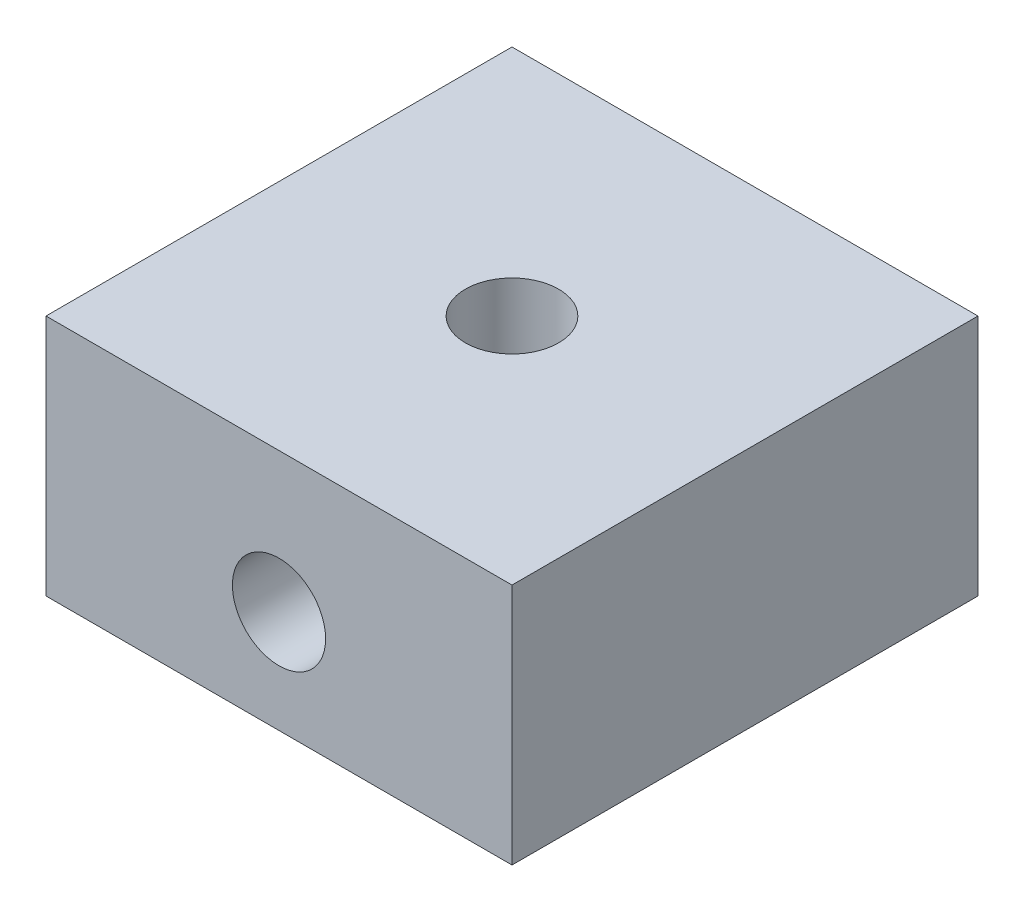
from build123d import *

# Parameters (mm, degrees)
BOSS_EXTRUDE1_DEPTH      = 25
BOSS_EXTRUDE1_DEPTH_BACK = 1.0186
SKETCH1_W                = 50
SKETCH1_H                = 50
SKETCH11_R               = 5
CUT_EXTRUDE17_DEPTH      = 15
SKETCH14_R               = 5
CUT_EXTRUDE18_DEPTH      = 25


with BuildPart() as part:
    # Sketch1 → Boss-Extrude1 (new, two sides: drawn at the far end of the back side and taken through both)
    with BuildSketch(Plane(origin=(0, 0, 0), x_dir=(1, 0, 0), z_dir=(0, 1, 0)).offset(-BOSS_EXTRUDE1_DEPTH_BACK)):
        Rectangle(SKETCH1_W, SKETCH1_H)
    extrude(amount=BOSS_EXTRUDE1_DEPTH + BOSS_EXTRUDE1_DEPTH_BACK)

    # Sketch10 → Cut-Revolve2 (revolve, cut)
    with BuildSketch(Plane.XY):
        with BuildLine():
            Line((-5, 10), (5, 10))
            ThreePointArc((5, 10), (0, 15), (-5, 10))
        make_face()
    revolve(axis=Axis((-5, 10, 0), (1, 0, 0)), mode=Mode.SUBTRACT)

    # Sketch11 → Cut-Extrude17 (cut)
    with BuildSketch(Plane(origin=(0, 25, 0), x_dir=(1, 0, 0), z_dir=(0, 1, 0))):
        with Locations(Location((0, 0, 0), (0, 0, 270))):
            Circle(SKETCH11_R)
    extrude(amount=-CUT_EXTRUDE17_DEPTH, mode=Mode.SUBTRACT)

    # Sketch14 → Cut-Extrude18 (cut)
    with BuildSketch(Plane.XY.offset(25)):
        with Locations((0, 10)):
            Circle(SKETCH14_R)
    extrude(amount=-CUT_EXTRUDE18_DEPTH, mode=Mode.SUBTRACT)


solid = part.part
